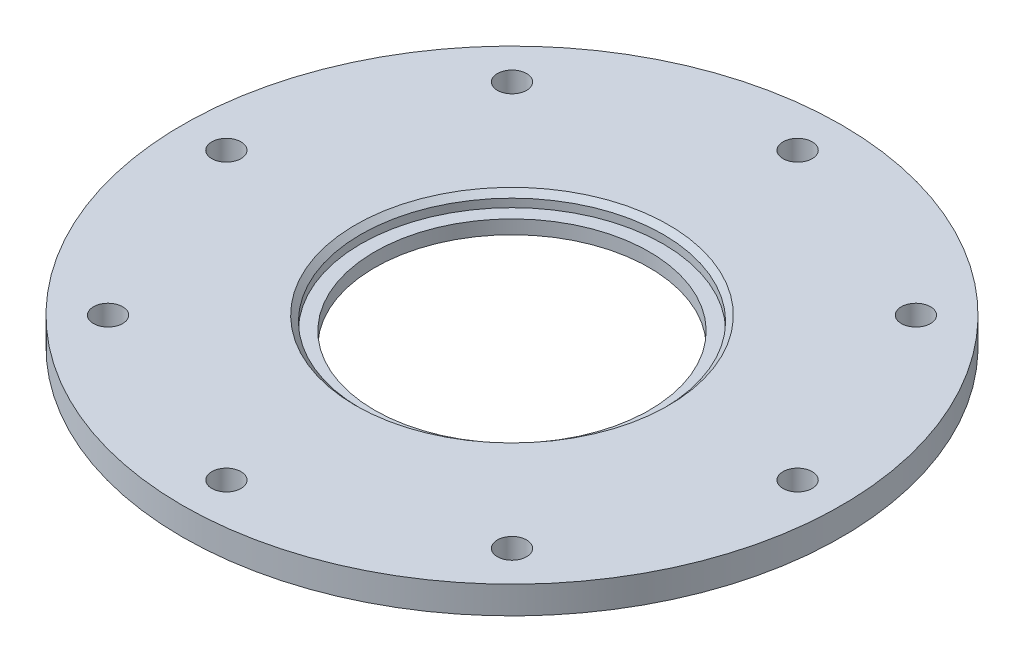
from build123d import *

# Parameters (mm, degrees)
SKETCH1_R           = 76.2
SKETCH1_R_2         = 34.925
BOSS_EXTRUDE1_DEPTH = 6.35
CIRPATTERN1_COUNT   = 8
CHAMFER1_SIZE       = 1.27
SKETCH6_R           = 34.925
SKETCH6_R_2         = 31.75
BOSS_EXTRUDE2_DEPTH = 3.175


with BuildPart() as part:
    # Sketch1 → Boss-Extrude1 (new body)
    with BuildSketch(Plane(origin=(0, 0, 0), x_dir=(1, 0, 0), z_dir=(0, 1, 0))):
        Circle(SKETCH1_R)
        Circle(SKETCH1_R_2, mode=Mode.SUBTRACT)
    extrude(amount=BOSS_EXTRUDE1_DEPTH)

    # Sketch4 → 1/4 Clearance Hole1 (revolve, cut)
    with BuildSketch(Plane(origin=(0, 6.35, 66.04), x_dir=(0, 0, 1), z_dir=(1, 0, 0))):
        Polygon((0, 0), (0, 27.429827343), (3.3782, 25.4), (3.3782, 0), align=None)
    f_1_4_clearance_hole1 = revolve(axis=Axis((0, 12.7, 66.04), (0, -1, 0)), mode=Mode.SUBTRACT)

    # CirPattern1: 1/4 Clearance Hole1 ×8 about axis
    cirpattern1_axis = Axis((0, 6.6675, 0), (0, -1, 0))
    for i in range(1, CIRPATTERN1_COUNT):
        add(f_1_4_clearance_hole1.rotate(cirpattern1_axis, i * 360 / CIRPATTERN1_COUNT), mode=Mode.SUBTRACT)

    # Chamfer1
    chamfer1_edges = [part.edges().sort_by_distance(p)[0] for p in [
        (-34.925, 6.35, 0),
    ]]
    chamfer(chamfer1_edges, length=CHAMFER1_SIZE)

    # Sketch6 → Boss-Extrude2 (add)
    with BuildSketch(Plane(origin=(0, 0, 0), x_dir=(1, 0, 0), z_dir=(0, 1, 0))):
        Circle(SKETCH6_R)
        Circle(SKETCH6_R_2, mode=Mode.SUBTRACT)
    extrude(amount=BOSS_EXTRUDE2_DEPTH)


solid = part.part
